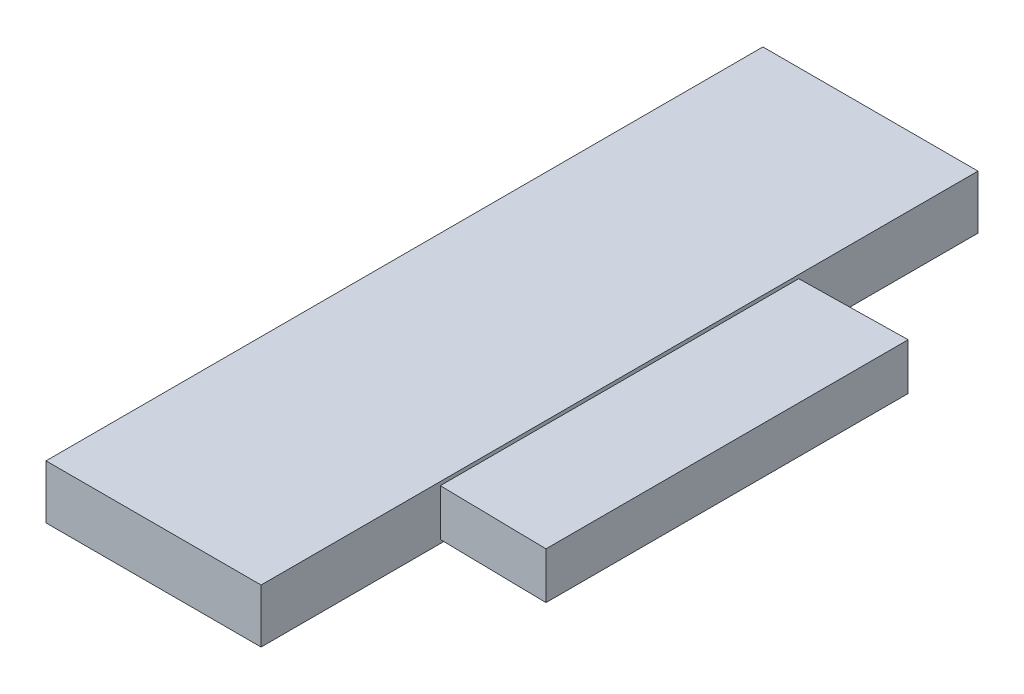
from build123d import *

# Parameters (mm, degrees)
SKETCH1_W           = 30
SKETCH1_H           = 100
BOSS_EXTRUDE1_DEPTH = 3.75
BOSS_EXTRUDE2_START = -0.5
BOSS_EXTRUDE2_DEPTH = 6.5


with BuildPart() as part:
    # Sketch1 → Boss-Extrude1 (new, symmetric)
    with BuildSketch(Plane(origin=(0, 0, 0), x_dir=(1, 0, 0), z_dir=(0, 1, 0))):
        with Locations((-15, 0)):
            Rectangle(SKETCH1_W, SKETCH1_H)
    extrude(amount=BOSS_EXTRUDE1_DEPTH, both=True)

    # Sketch2 → Boss-Extrude2 (add)
    with BuildSketch(Plane(origin=(0, 3.75, 0), x_dir=(1, 0, 0), z_dir=(0, 1, 0)).offset(BOSS_EXTRUDE2_START)):
        Polygon((0, 25), (15, 25.261825974), (15, -25.261825974), (0, -25), align=None)
    extrude(amount=-BOSS_EXTRUDE2_DEPTH)


solid = part.part
